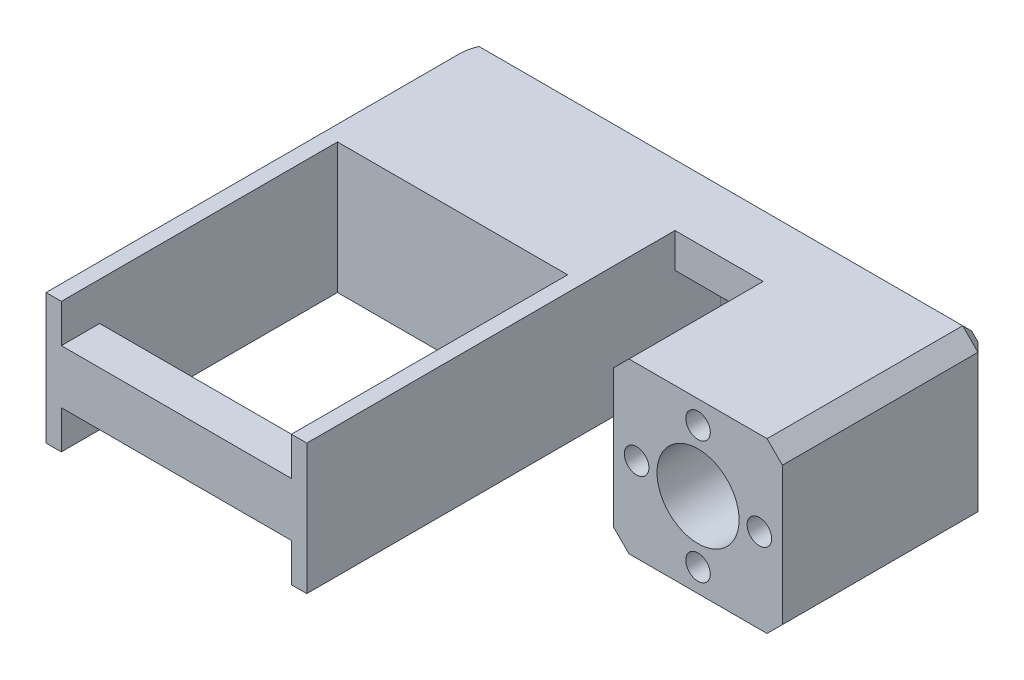
from build123d import *

# Parameters (mm, degrees)
SZKIC2_W                    = 34
SZKIC2_H                    = 38
SZKIC2_W_2                  = 30
SZKIC2_H_2                  = 31
DODANIE_WYCI_GNI_CIE1_DEPTH = 17
SZKIC6_W                    = 30
SZKIC6_H                    = 5
WYTNIJ_WYCI_GNI_CIE1_DEPTH  = 17
SZKIC7_W                    = 34
SZKIC7_H                    = 17
DODANIE_WYCI_GNI_CIE2_DEPTH = 10
SZKIC8_R                    = 11
SZKIC8_R_2                  = 5.35
SZKIC8_W                    = 7
SZKIC8_H                    = 4.5
SZKIC8_W_2                  = 34
SZKIC8_H_2                  = 17
DODANIE_WYCI_GNI_CIE3_DEPTH = 10
DODANIE_WYCI_GNI_CIE4_START = 17.5
SZKIC10_R                   = 11
SZKIC10_R_2                 = 5.35
DODANIE_WYCI_GNI_CIE4_DEPTH = 17.5
DODANIE_WYCI_GNI_CIE5_START = -16
SZKIC11_R                   = 5.35
SZKIC11_R_2                 = 4.2
DODANIE_WYCI_GNI_CIE5_DEPTH = 16
SZKIC13_R                   = 1.6
WYTNIJ_WYCI_GNI_CIE2_DEPTH  = 10
DODANIE_WYCI_GNI_CIE6_REACH = 79.494
SFAZOWANIE1_SIZE            = 2
SFAZOWANIE2_SIZE            = 2
SFAZOWANIE3_SIZE            = 2
ZAOKR_GLENIE1_R             = 5


with BuildPart() as part:
    # Szkic2 → Dodanie-wyciągnięcie1 (new body)
    with BuildSketch(Plane(origin=(0, 0, 0), x_dir=(1, 0, 0), z_dir=(0, 1, 0))):
        Rectangle(SZKIC2_W, SZKIC2_H)
        with Locations((0, 1.5)):
            Rectangle(SZKIC2_W_2, SZKIC2_H_2, mode=Mode.SUBTRACT)
    extrude(amount=DODANIE_WYCI_GNI_CIE1_DEPTH)

    # Szkic6 → Wytnij-wyciągnięcie1 (cut)
    with BuildSketch(Plane(origin=(0, 0, 14), x_dir=(-1, 0, 0), z_dir=(0, 0, -1))):
        with Locations((0, 14.5)):
            Rectangle(SZKIC6_W, SZKIC6_H)
        with Locations((0, 2.5)):
            Rectangle(SZKIC6_W, SZKIC6_H)
    extrude(amount=-WYTNIJ_WYCI_GNI_CIE1_DEPTH, mode=Mode.SUBTRACT)

    # Szkic7 → Dodanie-wyciągnięcie2 (add)
    with BuildSketch(Plane(origin=(0, 0, -19), x_dir=(-1, 0, 0), z_dir=(0, 0, -1))):
        with Locations((0, 8.5)):
            Rectangle(SZKIC7_W, SZKIC7_H)
    extrude(amount=DODANIE_WYCI_GNI_CIE2_DEPTH)

    # Szkic8 → Dodanie-wyciągnięcie3 (add)
    # profile 1 of 4: a face of its own
    with BuildSketch(Plane(origin=(0, 0, -29), x_dir=(-1, 0, 0), z_dir=(0, 0, -1))):
        with Locations((-37.5, 6)):
            Circle(SZKIC8_R)
        with Locations((-37.5, 6)):
            Circle(SZKIC8_R_2, mode=Mode.SUBTRACT)
    # profile 2 of 4: a face of its own
    with BuildSketch(Plane(origin=(0, 0, -29), x_dir=(-1, 0, 0), z_dir=(0, 0, -1))):
        with BuildLine():
            Line((-24, 12.5), (-24, 17))
            Line((-24, 17), (-37.5, 17))
            ThreePointArc((-37.5, 17), (-29.721825407, 13.778174593), (-26.5, 6))
            ThreePointArc((-26.5, 6), (-26.621602105, 4.368908572), (-26.983719863, 2.773879716))
            Line((-26.983719863, 2.773879716), (-24, 12.5))
        make_face()
    # profile 3 of 4: a face of its own
    with BuildSketch(Plane(origin=(0, 0, -29), x_dir=(-1, 0, 0), z_dir=(0, 0, -1))):
        with Locations((-20.5, 14.75)):
            Rectangle(SZKIC8_W, SZKIC8_H)
    # profile 4 of 4: a face of its own
    with BuildSketch(Plane(origin=(0, 0, -29), x_dir=(-1, 0, 0), z_dir=(0, 0, -1))):
        with Locations((0, 8.5)):
            Rectangle(SZKIC8_W_2, SZKIC8_H_2)
    extrude(amount=DODANIE_WYCI_GNI_CIE3_DEPTH)

    # Szkic10 → Dodanie-wyciągnięcie4 (add)
    with BuildSketch(Plane.XY.offset(-29).offset(DODANIE_WYCI_GNI_CIE4_START)):
        with Locations((37.5, 6)):
            Circle(SZKIC10_R)
        with Locations((37.5, 6)):
            Circle(SZKIC10_R_2, mode=Mode.SUBTRACT)
    extrude(amount=-DODANIE_WYCI_GNI_CIE4_DEPTH)

    # Szkic11 → Dodanie-wyciągnięcie5 (add)
    with BuildSketch(Plane(origin=(0, 0, -39), x_dir=(-1, 0, 0), z_dir=(0, 0, -1)).offset(DODANIE_WYCI_GNI_CIE5_START)):
        with Locations(Location((-37.5, 6, 0), (0, 0, 180))):
            Circle(SZKIC11_R)
        with Locations((-37.5, 6)):
            Circle(SZKIC11_R_2, mode=Mode.SUBTRACT)
    extrude(amount=DODANIE_WYCI_GNI_CIE5_DEPTH)

    # Szkic13 → Wytnij-wyciągnięcie2 (cut)
    with BuildSketch(Plane.XY.offset(-11.5)):
        with Locations((37.5, 14)):
            Circle(SZKIC13_R)
        with Locations((45.5, 6)):
            Circle(SZKIC13_R)
        with Locations((37.5, -2)):
            Circle(SZKIC13_R)
        with Locations((29.5, 6)):
            Circle(SZKIC13_R)
    extrude(amount=-WYTNIJ_WYCI_GNI_CIE2_DEPTH, mode=Mode.SUBTRACT)

    # Dodanie-wyciągnięcie6: up to this face of the body (flat: up to its plane)
    dodanie_wyci_gni_cie6_end = Plane(part.part.faces().sort_by_distance((26.811126984, 6, -11.5))[0])
    # Szkic16 → Dodanie-wyciągnięcie6 (add, up to the picked face)
    with BuildSketch(Plane(origin=(0, 0, -39), x_dir=(-1, 0, 0), z_dir=(0, 0, -1)), mode=Mode.PRIVATE) as dodanie_wyci_gni_cie6_sk1:
        with BuildLine():
            ThreePointArc((-48.5, 6), (-45.278174593, 13.778174593), (-37.5, 17))
            Line((-37.5, 17), (-48.5, 17))
            Line((-48.5, 17), (-48.5, 6))
        make_face()
    dodanie_wyci_gni_cie6_tool1 = split(extrude(dodanie_wyci_gni_cie6_sk1.sketch, amount=-DODANIE_WYCI_GNI_CIE6_REACH, mode=Mode.PRIVATE), bisect_by=dodanie_wyci_gni_cie6_end, keep=Keep.BOTH, mode=Mode.PRIVATE)
    # Szkic16 → Dodanie-wyciągnięcie6 (add, up to the picked face)
    with BuildSketch(Plane(origin=(0, 0, -39), x_dir=(-1, 0, 0), z_dir=(0, 0, -1)), mode=Mode.PRIVATE) as dodanie_wyci_gni_cie6_sk2:
        with BuildLine():
            Line((-26.5, 6), (-26.5, 17))
            Line((-26.5, 17), (-37.5, 17))
            ThreePointArc((-37.5, 17), (-29.721825407, 13.778174593), (-26.5, 6))
        make_face()
    dodanie_wyci_gni_cie6_tool2 = split(extrude(dodanie_wyci_gni_cie6_sk2.sketch, amount=-DODANIE_WYCI_GNI_CIE6_REACH, mode=Mode.PRIVATE), bisect_by=dodanie_wyci_gni_cie6_end, keep=Keep.BOTH, mode=Mode.PRIVATE)
    # Szkic16 → Dodanie-wyciągnięcie6 (add, up to the picked face)
    with BuildSketch(Plane(origin=(0, 0, -39), x_dir=(-1, 0, 0), z_dir=(0, 0, -1)), mode=Mode.PRIVATE) as dodanie_wyci_gni_cie6_sk3:
        with BuildLine():
            Line((-26.5, -5), (-26.5, 4.350675726))
            Line((-26.5, 4.350675726), (-26.983719863, 2.773879716))
            ThreePointArc((-26.983719863, 2.773879716), (-30.96116689, -2.84554473), (-37.5, -5))
            Line((-37.5, -5), (-26.5, -5))
        make_face()
    dodanie_wyci_gni_cie6_tool3 = split(extrude(dodanie_wyci_gni_cie6_sk3.sketch, amount=-DODANIE_WYCI_GNI_CIE6_REACH, mode=Mode.PRIVATE), bisect_by=dodanie_wyci_gni_cie6_end, keep=Keep.BOTH, mode=Mode.PRIVATE)
    # Szkic16 → Dodanie-wyciągnięcie6 (add, up to the picked face)
    with BuildSketch(Plane(origin=(0, 0, -39), x_dir=(-1, 0, 0), z_dir=(0, 0, -1)), mode=Mode.PRIVATE) as dodanie_wyci_gni_cie6_sk4:
        with BuildLine():
            ThreePointArc((-37.5, -5), (-45.278174593, -1.778174593), (-48.5, 6))
            Line((-48.5, 6), (-48.5, -5))
            Line((-48.5, -5), (-37.5, -5))
        make_face()
    dodanie_wyci_gni_cie6_tool4 = split(extrude(dodanie_wyci_gni_cie6_sk4.sketch, amount=-DODANIE_WYCI_GNI_CIE6_REACH, mode=Mode.PRIVATE), bisect_by=dodanie_wyci_gni_cie6_end, keep=Keep.BOTH, mode=Mode.PRIVATE)
    # Szkic16 → Dodanie-wyciągnięcie6 (add, up to the picked face)
    with BuildSketch(Plane(origin=(0, 0, -39), x_dir=(-1, 0, 0), z_dir=(0, 0, -1)), mode=Mode.PRIVATE) as dodanie_wyci_gni_cie6_sk5:
        with BuildLine():
            Line((-26.5, 4.350675726), (-26.5, 6))
            ThreePointArc((-26.5, 6), (-26.621602105, 4.368908572), (-26.983719863, 2.773879716))
            Line((-26.983719863, 2.773879716), (-26.5, 4.350675726))
        make_face()
    dodanie_wyci_gni_cie6_tool5 = split(extrude(dodanie_wyci_gni_cie6_sk5.sketch, amount=-DODANIE_WYCI_GNI_CIE6_REACH, mode=Mode.PRIVATE), bisect_by=dodanie_wyci_gni_cie6_end, keep=Keep.BOTH, mode=Mode.PRIVATE)
    add(dodanie_wyci_gni_cie6_tool1.solids().sort_by(Axis((46.042953, 14.542953, -39), (0, 0, 1)))[0])
    add(dodanie_wyci_gni_cie6_tool2.solids().sort_by(Axis((28.957047, 14.542953, -39), (0, 0, 1)))[0])
    add(dodanie_wyci_gni_cie6_tool3.solids().sort_by(Axis((28.969303, -2.578828, -39), (0, 0, 1)))[0])
    add(dodanie_wyci_gni_cie6_tool4.solids().sort_by(Axis((46.042953, -2.542953, -39), (0, 0, 1)))[0])
    add(dodanie_wyci_gni_cie6_tool5.solids().sort_by(Axis((26.597113, 4.365237, -39), (0, 0, 1)))[0])

    # Sfazowanie1
    sfazowanie1_edges = [part.edges().sort_by_distance(p)[0] for p in [
        (48.5, 17, -25.25),
        (26.5, 17, -20.25),
        (48.5, -5, -25.25),
        (26.5, -5, -25.25),
    ]]
    chamfer(sfazowanie1_edges, length=SFAZOWANIE1_SIZE)

    # Sfazowanie2
    sfazowanie2_edges = [part.edges().sort_by_distance(p)[0] for p in [
        (17, 6.25, -39),
        (0, 0, -39),
        (-17, 8.5, -39),
    ]]
    chamfer(sfazowanie2_edges, length=SFAZOWANIE2_SIZE)

    # Sfazowanie3
    sfazowanie3_edges = [part.edges().sort_by_distance(p)[0] for p in [
        (19.5, 12.5, -39),
        (15.75, 17, -39),
        (47.5, 16, -39),
        (48.5, 6, -39),
        (47.5, -4, -39),
        (37.5, -5, -39),
        (27.5, -4, -39),
        (26.5, 0.675337863, -39),
        (25.25, 8.425337863, -39),
    ]]
    chamfer(sfazowanie3_edges, length=SFAZOWANIE3_SIZE)

    # Zaokrąglenie1
    zaokr_glenie1_edges = [part.edges().sort_by_distance(p)[0] for p in [
        (17, 6.25, -37),
        (-17, 8.5, -37),
    ]]
    fillet(zaokr_glenie1_edges, radius=ZAOKR_GLENIE1_R)


solid = part.part
